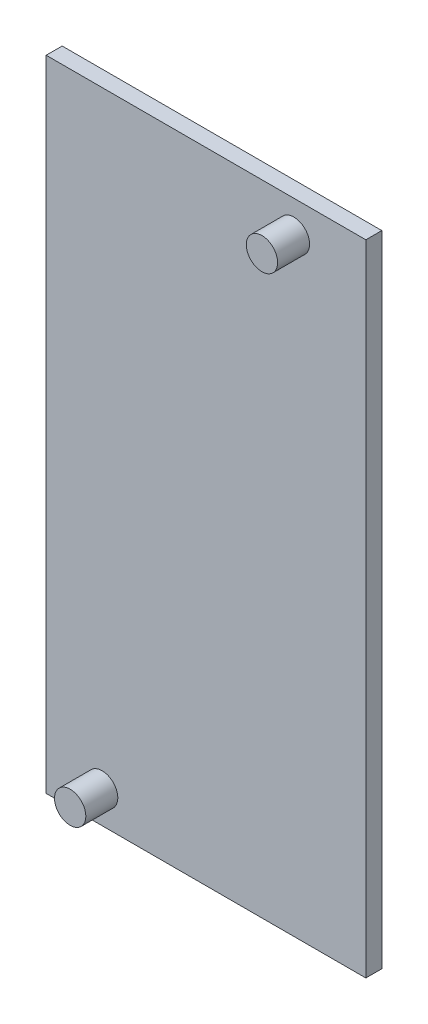
from build123d import *

# Parameters (mm, degrees)
SKETCH1_W           = 100
SKETCH1_H           = 200
BOSS_EXTRUDE1_DEPTH = 5
SKETCH2_R           = 4.9
BOSS_EXTRUDE2_DEPTH = 10


with BuildPart() as part:
    # Sketch1 → Boss-Extrude1 (new body)
    with BuildSketch(Plane.XY):
        with Locations((50, 100)):
            Rectangle(SKETCH1_W, SKETCH1_H)
    extrude(amount=BOSS_EXTRUDE1_DEPTH)

    # Sketch2 → Boss-Extrude2 (add)
    with BuildSketch(Plane.XY.offset(5)):
        with Locations(Location((17.5, 10, 0), (0, 0, 180))):
            Circle(SKETCH2_R)
        with Locations(Location((77.5, 190, 0), (0, 0, 180))):
            Circle(SKETCH2_R)
    extrude(amount=BOSS_EXTRUDE2_DEPTH)


solid = part.part
